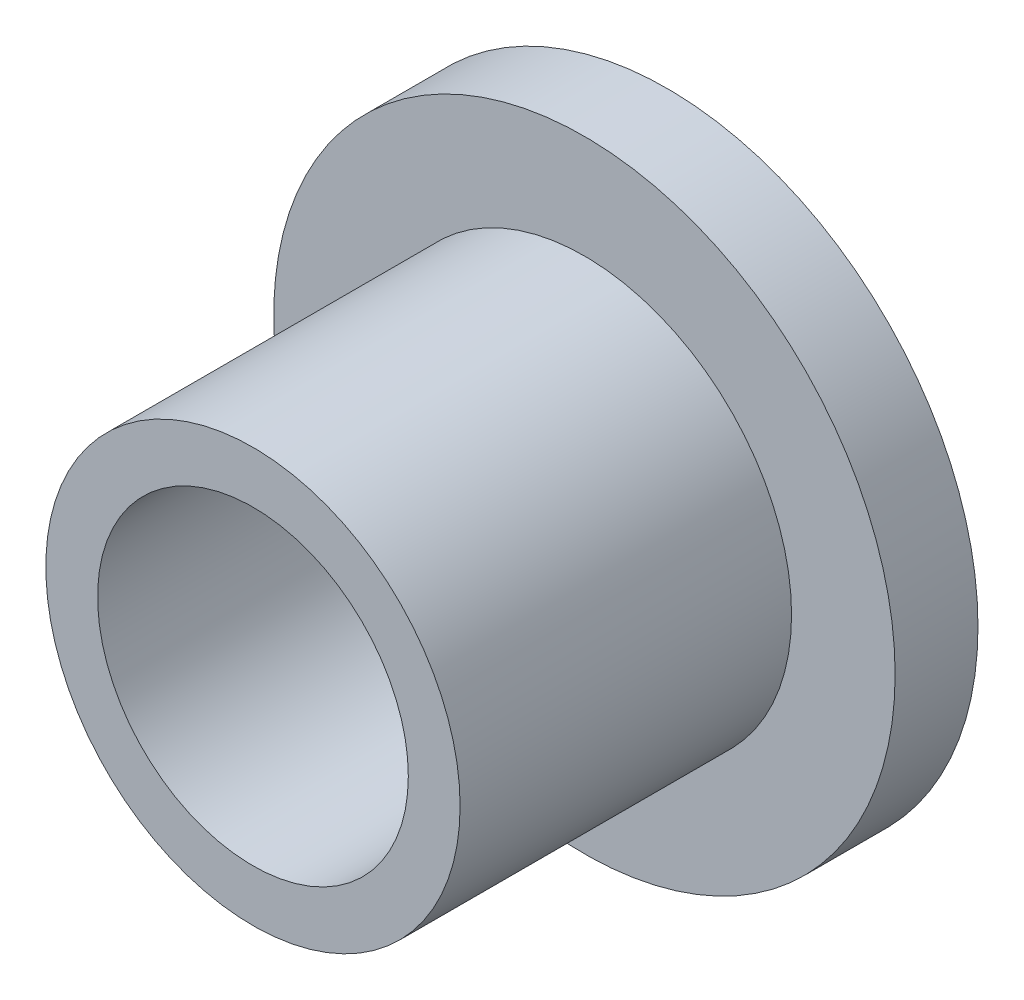
from build123d import *

# Parameters (mm, degrees)
SKETCH1_R           = 9.525
BOSS_EXTRUDE1_DEPTH = 2.54
SKETCH2_R           = 6.35
BOSS_EXTRUDE3_DEPTH = 10.16
SKETCH4_R           = 4.7625
CUT_EXTRUDE1_DEPTH  = 25.4


with BuildPart() as part:
    # Sketch1 → Boss-Extrude1 (new body)
    with BuildSketch(Plane.XY):
        Circle(SKETCH1_R)
    extrude(amount=BOSS_EXTRUDE1_DEPTH)

    # Sketch2 → Boss-Extrude3 (add)
    with BuildSketch(Plane.XY.offset(2.54)):
        Circle(SKETCH2_R)
    extrude(amount=BOSS_EXTRUDE3_DEPTH)

    # Sketch4 → Cut-Extrude1 (cut)
    with BuildSketch(Plane.XY.offset(12.7)):
        Circle(SKETCH4_R)
    extrude(amount=-CUT_EXTRUDE1_DEPTH, mode=Mode.SUBTRACT)


solid = part.part
